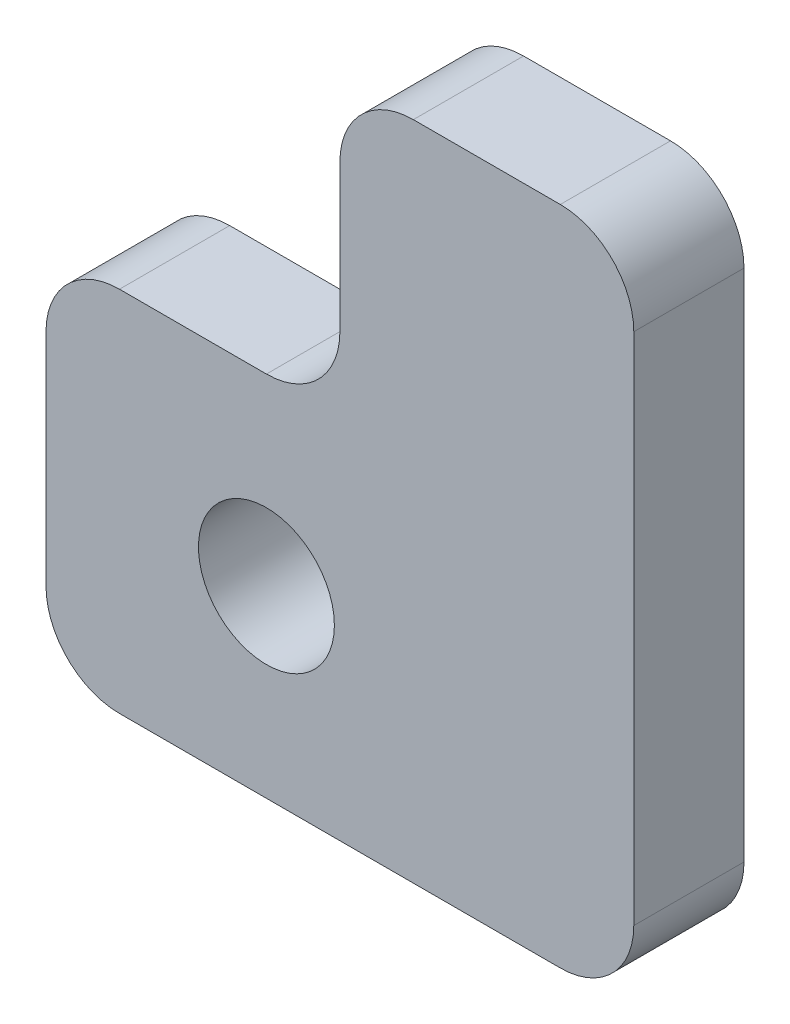
from build123d import *

# Parameters (mm, degrees)
BOSS_EXTRUDE3_DEPTH = 12
SKETCH4_R           = 1.85
CUT_EXTRUDE1_DEPTH  = 12
SKETCH5_W           = 3
SKETCH5_H           = 18
BOSS_EXTRUDE4_DEPTH = 4
FILLET2_R           = 2


with BuildPart() as part:
    # Sketch3 → Boss-Extrude3 (new body)
    with BuildSketch(Plane.ZY.offset(178.52034041)):
        Polygon((-3, 14.935767061), (-5.250229512, 13.135583451), (-3, 11.335399842), (-3, 8.134419599), (0, 8.134419599), (0, 18.136747304), (-3, 18.136747304), align=None)
    extrude(amount=-BOSS_EXTRUDE3_DEPTH)

    # Sketch4 → Cut-Extrude1 (cut)
    with BuildSketch(Plane.XY):
        with Locations((-172.52034041, 13.136747304)):
            Circle(SKETCH4_R)
    extrude(amount=-CUT_EXTRUDE1_DEPTH, mode=Mode.SUBTRACT)

    # Sketch5 → Boss-Extrude4 (add, symmetric)
    with BuildSketch(Plane(origin=(-166.52034041, 0, 0), x_dir=(0, 0, -1), z_dir=(1, 0, 0))):
        with Locations((1.5, 17.134419599)):
            Rectangle(SKETCH5_W, SKETCH5_H)
    extrude(amount=BOSS_EXTRUDE4_DEPTH, both=True)

    # Fillet2
    fillet2_edges = [part.edges().sort_by_distance(p)[0] for p in [
        (-170.52034041, 18.136747304, -1.5),
        (-170.52034041, 26.134419599, -1.5),
        (-162.52034041, 8.134419599, -1.5),
        (-162.52034041, 26.134419599, -1.5),
        (-178.52034041, 18.136747304, -1.5),
        (-178.52034041, 8.134419599, -1.5),
    ]]
    fillet(fillet2_edges, radius=FILLET2_R)


solid = part.part
